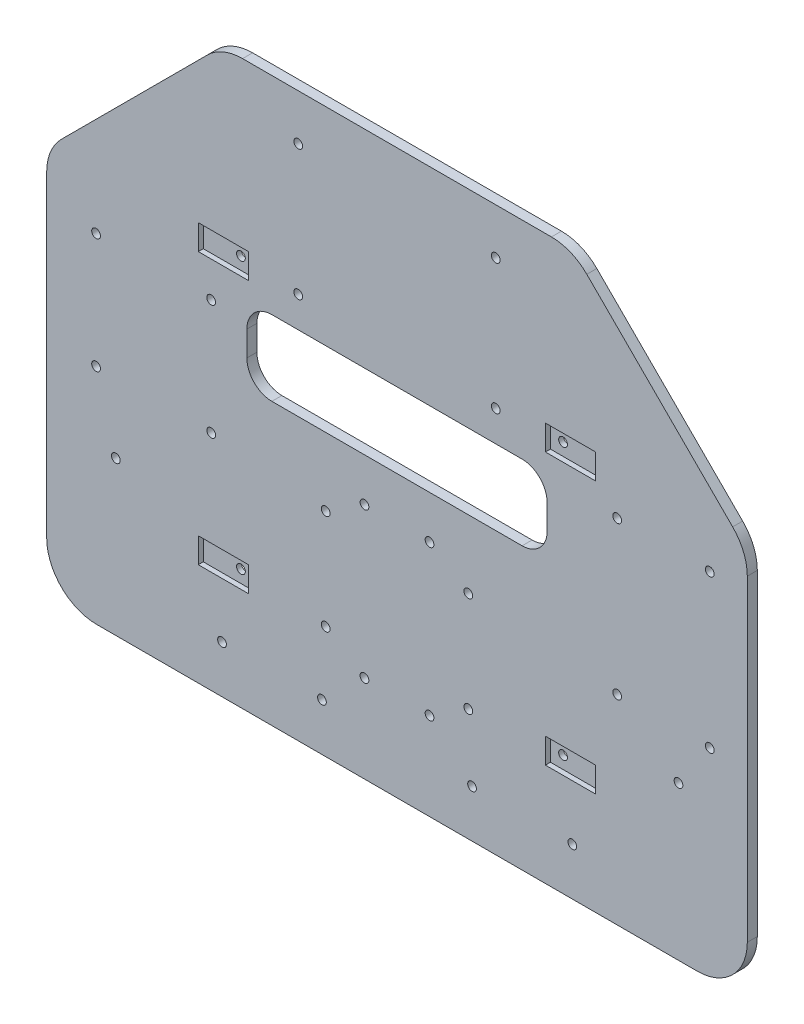
from build123d import *

# Parameters (mm, degrees)
EXTRUDE_1_DEPTH      = 4
SKETCH_6_R           = 1.75
CUT_EXTRUDE_3_DEPTH  = 4
SKETCH_4_R           = 1.75
CUT_EXTRUDE_4_DEPTH  = 4
SKETCH_7_R           = 1.75
CUT_EXTRUDE_5_DEPTH  = 4
SKETCH_8_R           = 1.75
CUT_EXTRUDE_6_DEPTH  = 4
CUT_EXTRUDE_7_DEPTH  = 4
SKETCH_10_R          = 1.75
SKETCH_10_R_2        = 1.749999998
CUT_EXTRUDE_9_DEPTH  = 4
SKETCH_11_W          = 20.115281517
SKETCH_11_H          = 10.033042315
SKETCH_11_R          = 1.75
CUT_EXTRUDE_10_DEPTH = 2
SKETCH_11_5_R        = 1.75
CUT_EXTRUDE_11_DEPTH = 10
SKETCH_12_R          = 1.75
CUT_EXTRUDE_13_DEPTH = 379.008231755


with BuildPart() as part:
    # 草图3 → 凸台-拉伸1 (new body)
    with BuildSketch(Plane.XY):
        with BuildLine():
            Line((73.505746565, 259.089488009), (196.937204075, 259.089488009))
            ThreePointArc((196.937204075, 259.089488009), (204.590872722, 257.56707866), (211.079339699, 253.231623633))
            Line((211.079339699, 253.231623633), (269.363610944, 194.947352388))
            ThreePointArc((269.363610944, 194.947352388), (273.69906597, 188.458885412), (275.22147532, 180.805216764))
            Line((275.22147532, 180.805216764), (275.22147532, 54.089488009))
            ThreePointArc((275.22147532, 54.089488009), (269.363610944, 39.947352386), (255.22147532, 34.089488009))
            Line((255.22147532, 34.089488009), (15.221475318, 34.089488009))
            ThreePointArc((15.221475318, 34.089488009), (1.079339694, 39.947352386), (-4.778524682, 54.089488009))
            Line((-4.778524682, 54.089488009), (-4.778524682, 180.805216762))
            ThreePointArc((-4.778524682, 180.805216762), (-3.256115333, 188.458885409), (1.079339694, 194.947352386))
            Line((1.079339694, 194.947352386), (59.363610941, 253.231623633))
            ThreePointArc((59.363610941, 253.231623633), (65.852077918, 257.56707866), (73.505746565, 259.089488009))
        make_face()
    extrude(amount=EXTRUDE_1_DEPTH)

    # 草图6 → 切除-拉伸3 (cut)
    with BuildSketch(Plane.XY.offset(4)):
        with Locations((223.22147532, 174.880072532)):
            Circle(SKETCH_6_R)
        with Locations((260.22147532, 174.880072532)):
            Circle(SKETCH_6_R)
        with Locations((260.22147532, 113.880072532)):
            Circle(SKETCH_6_R)
        with Locations((223.22147532, 113.880072532)):
            Circle(SKETCH_6_R)
    extrude(amount=-CUT_EXTRUDE_3_DEPTH, mode=Mode.SUBTRACT)

    # 草图4 → 切除-拉伸4 (cut)
    with BuildSketch(Plane.XY.offset(4)):
        with Locations((174.691475319, 240.74535793)):
            Circle(SKETCH_4_R)
        with Locations((174.691475319, 188.63535793)):
            Circle(SKETCH_4_R)
        with Locations((95.751475319, 188.63535793)):
            Circle(SKETCH_4_R)
        with Locations((95.751475319, 240.74535793)):
            Circle(SKETCH_4_R)
        with Locations((165.22147532, 53.06830954)):
            Circle(SKETCH_4_R)
        with Locations((105.22147532, 53.06830954)):
            Circle(SKETCH_4_R)
    extrude(amount=-CUT_EXTRUDE_4_DEPTH, mode=Mode.SUBTRACT)

    # 草图7 → 切除-拉伸5 (cut)
    with BuildSketch(Plane.XY.offset(4)):
        with Locations((122.221475319, 129.089488009)):
            Circle(SKETCH_7_R)
        with Locations((148.221475319, 129.089488009)):
            Circle(SKETCH_7_R)
        with Locations((122.221475319, 69.089488009)):
            Circle(SKETCH_7_R)
        with Locations((148.221475319, 69.089488009)):
            Circle(SKETCH_7_R)
    extrude(amount=-CUT_EXTRUDE_5_DEPTH, mode=Mode.SUBTRACT)

    # 草图8 → 切除-拉伸6 (cut)
    with BuildSketch(Plane.XY.offset(4)):
        with Locations((22.867250591, 95.494716411)):
            Circle(SKETCH_8_R)
        with Locations((65.293657462, 53.06830954)):
            Circle(SKETCH_8_R)
        with Locations((247.720064334, 95.494716411)):
            Circle(SKETCH_8_R)
        with Locations((205.293657462, 53.06830954)):
            Circle(SKETCH_8_R)
    extrude(amount=-CUT_EXTRUDE_6_DEPTH, mode=Mode.SUBTRACT)

    # 草图9 → 切除-拉伸7 (cut)
    with BuildSketch(Plane.XY.offset(4)):
        with BuildLine():
            Line((135.22147532, 176.324698125), (85.22147532, 176.324698125))
            ThreePointArc((85.22147532, 176.324698125), (78.150407508, 173.395765937), (75.22147532, 166.324698125))
            Line((75.22147532, 166.324698125), (75.22147532, 156.324698125))
            ThreePointArc((75.22147532, 156.324698125), (78.150407508, 149.253630313), (85.22147532, 146.324698125))
            Line((85.22147532, 146.324698125), (185.22147532, 146.324698125))
            ThreePointArc((185.22147532, 146.324698125), (192.292543132, 149.253630313), (195.22147532, 156.324698125))
            Line((195.22147532, 156.324698125), (195.22147532, 166.324698125))
            ThreePointArc((195.22147532, 166.324698125), (192.292543132, 173.395765937), (185.22147532, 176.324698125))
            Line((185.22147532, 176.324698125), (135.22147532, 176.324698125))
        make_face()
    extrude(amount=-CUT_EXTRUDE_7_DEPTH, mode=Mode.SUBTRACT)

    # 草图10 → 切除-拉伸9 (cut)
    with BuildSketch(Plane.XY.offset(4)):
        with Locations((106.721475319, 79.089488009)):
            Circle(SKETCH_10_R)
        with Locations((163.721475321, 79.089488009)):
            Circle(SKETCH_10_R_2)
        with Locations((106.721475319, 119.089488009)):
            Circle(SKETCH_10_R)
        with Locations((163.721475321, 119.089488009)):
            Circle(SKETCH_10_R)
    extrude(amount=-CUT_EXTRUDE_9_DEPTH, mode=Mode.SUBTRACT)

    # 草图11 → 切除-拉伸10 (cut)
    # profile 1 of 4: a face of its own
    with BuildSketch(Plane.XY.offset(4)):
        with Locations((65.852077918, 188.458885409)):
            Rectangle(SKETCH_11_W, SKETCH_11_H)
        with Locations((70.852077918, 188.458885409)):
            Circle(SKETCH_11_R, mode=Mode.SUBTRACT)
    # profile 2 of 4: a face of its own
    with BuildSketch(Plane.XY.offset(4)):
        with Locations((65.852077918, 80.084611013)):
            Rectangle(SKETCH_11_W, SKETCH_11_H)
        with Locations((70.852077918, 80.084611013)):
            Circle(SKETCH_11_R, mode=Mode.SUBTRACT)
    # profile 3 of 4: a face of its own
    with BuildSketch(Plane.XY.offset(4)):
        with Locations((204.590872723, 188.458885409)):
            Rectangle(SKETCH_11_W, SKETCH_11_H)
        with Locations((199.590872722, 188.458885409)):
            Circle(SKETCH_11_R, mode=Mode.SUBTRACT)
    # profile 4 of 4: a face of its own
    with BuildSketch(Plane.XY.offset(4)):
        with Locations((204.590872723, 80.084611013)):
            Rectangle(SKETCH_11_W, SKETCH_11_H)
        with Locations((199.590872722, 80.084611013)):
            Circle(SKETCH_11_R, mode=Mode.SUBTRACT)
    extrude(amount=-CUT_EXTRUDE_10_DEPTH, mode=Mode.SUBTRACT)

    # 草图11<5> → 切除-拉伸11 (cut)
    with BuildSketch(Plane.XY.offset(4)):
        with Locations((70.852077918, 188.458885409)):
            Circle(SKETCH_11_5_R)
        with Locations((70.852077918, 80.084611013)):
            Circle(SKETCH_11_5_R)
        with Locations((199.590872722, 80.084611013)):
            Circle(SKETCH_11_5_R)
        with Locations((199.590872722, 188.458885409)):
            Circle(SKETCH_11_5_R)
    extrude(amount=-CUT_EXTRUDE_11_DEPTH, mode=Mode.SUBTRACT)

    # 草图12 → 切除-拉伸13 (cut, through all)
    with BuildSketch(Plane.XY.offset(4)):
        with Locations((60.961423691, 169.312171827)):
            Circle(SKETCH_12_R)
        with Locations((60.961423691, 123.312171827)):
            Circle(SKETCH_12_R)
        with Locations((14.961423691, 123.312171827)):
            Circle(SKETCH_12_R)
        with Locations((14.961423691, 169.312171827)):
            Circle(SKETCH_12_R)
    extrude(amount=-CUT_EXTRUDE_13_DEPTH, mode=Mode.SUBTRACT)


solid = part.part
